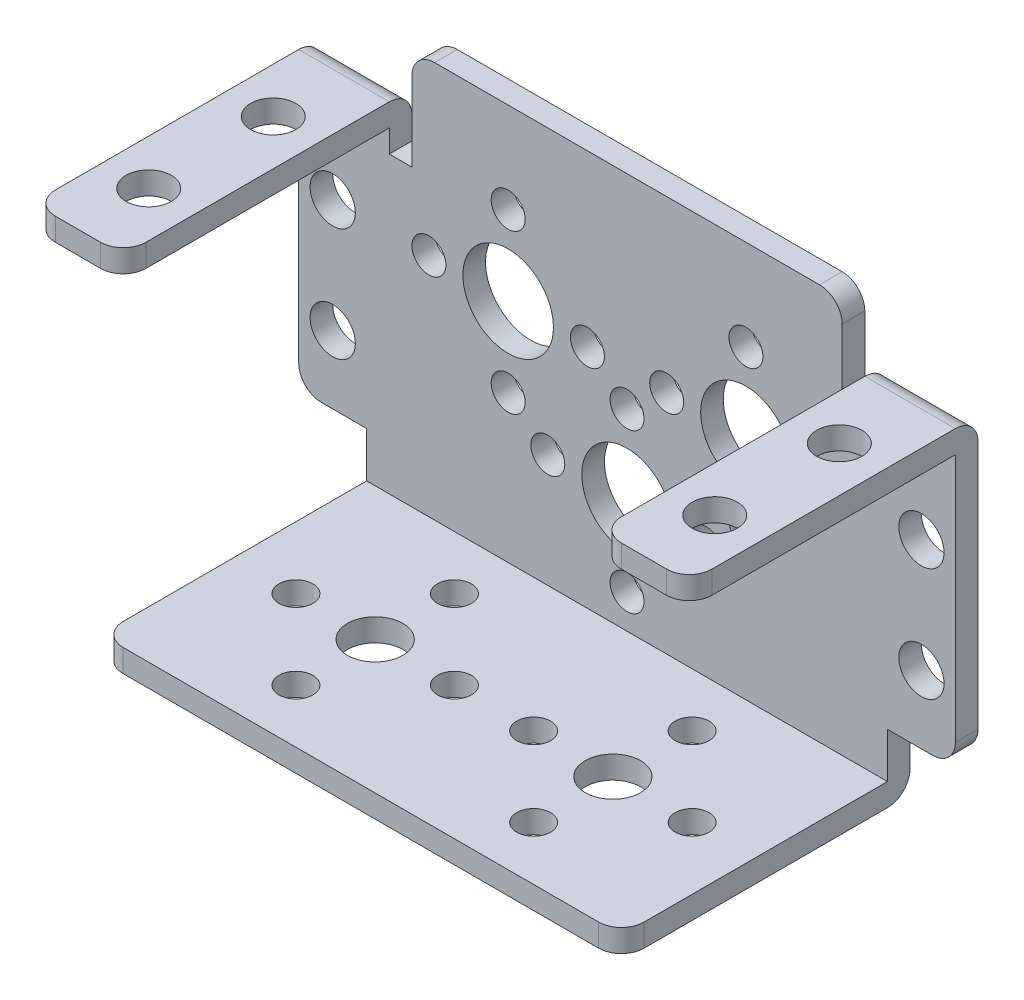
from build123d import *

# Parameters (mm, degrees)
SKETCH_3_W             = 58
SKETCH_3_H             = 37
EXTRUDE_1_DEPTH        = 2
SKETCH_4_W             = 58
SKETCH_4_H             = 2
EXTRUDE_2_DEPTH        = 23.5
SKETCH_5_W             = 8
SKETCH_5_H             = 2
EXTRUDE_3_DEPTH        = 23.5
PATTERN_LINEAR_1_COUNT = 2
PATTERN_LINEAR_1_PITCH = 50
SKETCH_6_W             = 6
SKETCH_6_H             = 6
CUT_EXTRUDE_1_DEPTH    = 44.950905628
PATTERN_LINEAR_2_COUNT = 2
PATTERN_LINEAR_2_PITCH = 52
CUT_EXTRUDE_2_DEPTH    = 23.5
CUT_EXTRUDE_3_DEPTH    = 23.5
SKETCH_9_R             = 2
SKETCH_9_R_2           = 4
SKETCH_9_R_3           = 1.5
CUT_EXTRUDE_4_DEPTH    = 23.5
SKETCH_11_R            = 2.447120917
SKETCH_11_R_2          = 1.5
CUT_EXTRUDE_5_DEPTH    = 53.925233976
FILLET_1_R             = 2
SKETCH_12_R            = 2
CUT_EXTRUDE_6_DEPTH    = 23.5


with BuildPart() as part:
    # 草图3 → 凸台-拉伸1 (new body)
    with BuildSketch(Plane.XY):
        with Locations((-1.42746114, 2.797927461)):
            Rectangle(SKETCH_3_W, SKETCH_3_H)
    extrude(amount=EXTRUDE_1_DEPTH)

    # 草图4 → 凸台-拉伸2 (add)
    with BuildSketch(Plane.XY.offset(2)):
        with Locations((-1.42746114, -14.702072539)):
            Rectangle(SKETCH_4_W, SKETCH_4_H)
    extrude(amount=EXTRUDE_2_DEPTH)

    # 草图5 → 凸台-拉伸3 (add)
    with BuildSketch(Plane.XY.offset(2)):
        with Locations((-26.42746114, 15.297927461)):
            Rectangle(SKETCH_5_W, SKETCH_5_H)
    extrude_3 = extrude(amount=EXTRUDE_3_DEPTH)

    # 阵列(线性)1: 凸台-拉伸3 ×2
    with Locations(*[(i * PATTERN_LINEAR_1_PITCH, 0, 0) for i in range(1, PATTERN_LINEAR_1_COUNT)]):
        add(extrude_3)

    # 草图6 → 切除-拉伸1 (cut, symmetric)
    with BuildSketch(Plane.XY.offset(2)):
        with Locations((-27.42746114, -12.702072539)):
            Rectangle(SKETCH_6_W, SKETCH_6_H)
    cut_extrude_1 = extrude(amount=CUT_EXTRUDE_1_DEPTH, both=True, mode=Mode.SUBTRACT)

    # 阵列(线性)2: 切除-拉伸1 ×2
    with Locations(*[(i * PATTERN_LINEAR_2_PITCH, 0, 0) for i in range(1, PATTERN_LINEAR_2_COUNT)]):
        add(cut_extrude_1, mode=Mode.SUBTRACT)

    # 草图7 → 切除-拉伸2 (cut)
    with BuildSketch(Plane.XY.offset(2)):
        Polygon((-30.42746114, 21.297927461), (-30.42746114, 16.297927461), (-22.42746114, 16.297927461), (-22.42746114, 14.297927461), (-22.42746114, 12.297927461), (-20.42746114, 12.297927461), (-20.42746114, 21.297927461), align=None)
    extrude(amount=-CUT_EXTRUDE_2_DEPTH, mode=Mode.SUBTRACT)

    # 草图8 → 切除-拉伸3 (cut)
    with BuildSketch(Plane.XY.offset(2)):
        Polygon((27.57253886, 16.297927461), (27.57253886, 21.297927461), (17.57253886, 21.297927461), (17.57253886, 12.297927461), (19.57253886, 12.297927461), (19.57253886, 16.297927461), align=None)
    extrude(amount=-CUT_EXTRUDE_3_DEPTH, mode=Mode.SUBTRACT)

    # 草图9 → 切除-拉伸4 (cut)
    with BuildSketch(Plane.XY.offset(2)):
        with Locations((-27.42746114, 6.297927461)):
            Circle(SKETCH_9_R)
        with Locations((-27.42746114, -3.702072539)):
            Circle(SKETCH_9_R)
        with Locations((-11.92746114, 6.297927461)):
            Circle(SKETCH_9_R_2)
        with Locations((-1.42746114, -3.702072539)):
            Circle(SKETCH_9_R_2)
        with Locations((-1.42746114, 3.297927461)):
            Circle(SKETCH_9_R_3)
        with Locations((-1.42746114, -10.702072539)):
            Circle(SKETCH_9_R_3)
        with Locations((-11.92746114, -0.702072539)):
            Circle(SKETCH_9_R_3)
        with Locations((-11.92746114, 13.297927461)):
            Circle(SKETCH_9_R_3)
        with Locations((-18.92746114, 6.297927461)):
            Circle(SKETCH_9_R_3)
        with Locations((-4.92746114, 6.297927461)):
            Circle(SKETCH_9_R_3)
        with Locations((-8.42746114, -3.702072539)):
            Circle(SKETCH_9_R_3)
        with Locations((5.57253886, -3.702072539)):
            Circle(SKETCH_9_R_3)
        with Locations((9.07253886, 13.297927461)):
            Circle(SKETCH_9_R_3)
        with Locations((2.07253886, 6.297927461)):
            Circle(SKETCH_9_R_3)
        with Locations((9.07253886, -0.702072539)):
            Circle(SKETCH_9_R_3)
        with Locations((9.07253886, 6.297927461)):
            Circle(SKETCH_9_R_2)
        with Locations((16.07253886, 6.297927461)):
            Circle(SKETCH_9_R_3)
        with Locations((24.57253886, -3.702072539)):
            Circle(SKETCH_9_R)
        with Locations((24.57253886, 6.297927461)):
            Circle(SKETCH_9_R)
    extrude(amount=-CUT_EXTRUDE_4_DEPTH, mode=Mode.SUBTRACT)

    # 草图11 → 切除-拉伸5 (cut, through all)
    with BuildSketch(Plane(origin=(0, -13.702072539, 0), x_dir=(1, 0, 0), z_dir=(0, 1, 0))):
        with Locations(Location((-11.92746114, -13.75, 0), (0, 0, 270))):
            Circle(SKETCH_11_R)
        with Locations(Location((-18.92746114, -13.75, 0), (0, 0, 270))):
            Circle(SKETCH_11_R_2)
        with Locations(Location((-11.92746114, -20.75, 0), (0, 0, 270))):
            Circle(SKETCH_11_R_2)
        with Locations(Location((-4.92746114, -13.75, 0), (0, 0, 270))):
            Circle(SKETCH_11_R_2)
        with Locations(Location((-11.92746114, -6.75, 0), (0, 0, 270))):
            Circle(SKETCH_11_R_2)
        with Locations(Location((9.07253886, -20.75, 0), (0, 0, 90))):
            Circle(SKETCH_11_R_2)
        with Locations(Location((2.07253886, -13.75, 0), (0, 0, 90))):
            Circle(SKETCH_11_R_2)
        with Locations(Location((9.07253886, -6.75, 0), (0, 0, 90))):
            Circle(SKETCH_11_R_2)
        with Locations(Location((9.07253886, -13.75, 0), (0, 0, 90))):
            Circle(SKETCH_11_R)
        with Locations(Location((16.07253886, -13.75, 0), (0, 0, 90))):
            Circle(SKETCH_11_R_2)
    extrude(amount=-CUT_EXTRUDE_5_DEPTH, mode=Mode.SUBTRACT)

    # 圆角1
    fillet_1_edges = [part.edges().sort_by_distance(p)[0] for p in [
        (-1.42746114, -15.702072539, 0),
        (-30.42746114, -9.702072539, 1),
        (27.57253886, -9.702072539, 1),
        (-20.42746114, 21.297927461, 1),
        (17.57253886, 21.297927461, 1),
        (23.57253886, 16.297927461, 0),
        (-26.42746114, 16.297927461, 0),
        (27.57253886, 15.297927461, 25.5),
        (19.57253886, 15.297927461, 25.5),
        (21.57253886, -14.702072539, 25.5),
        (-24.42746114, -14.702072539, 25.5),
        (-22.42746114, 15.297927461, 25.5),
        (-30.42746114, 15.297927461, 25.5),
    ]]
    fillet(fillet_1_edges, radius=FILLET_1_R)

    # 草图12 → 切除-拉伸6 (cut)
    with BuildSketch(Plane(origin=(0, 16.297927461, 0), x_dir=(1, 0, 0), z_dir=(0, 1, 0))):
        with Locations(Location((-26.42746114, -19.25, 0), (0, 0, 270))):
            Circle(SKETCH_12_R)
        with Locations(Location((-26.42746114, -8.25, 0), (0, 0, 270))):
            Circle(SKETCH_12_R)
        with Locations(Location((23.57253886, -19.25, 0), (0, 0, 270))):
            Circle(SKETCH_12_R)
        with Locations(Location((23.57253886, -8.25, 0), (0, 0, 270))):
            Circle(SKETCH_12_R)
    extrude(amount=-CUT_EXTRUDE_6_DEPTH, mode=Mode.SUBTRACT)


solid = part.part
